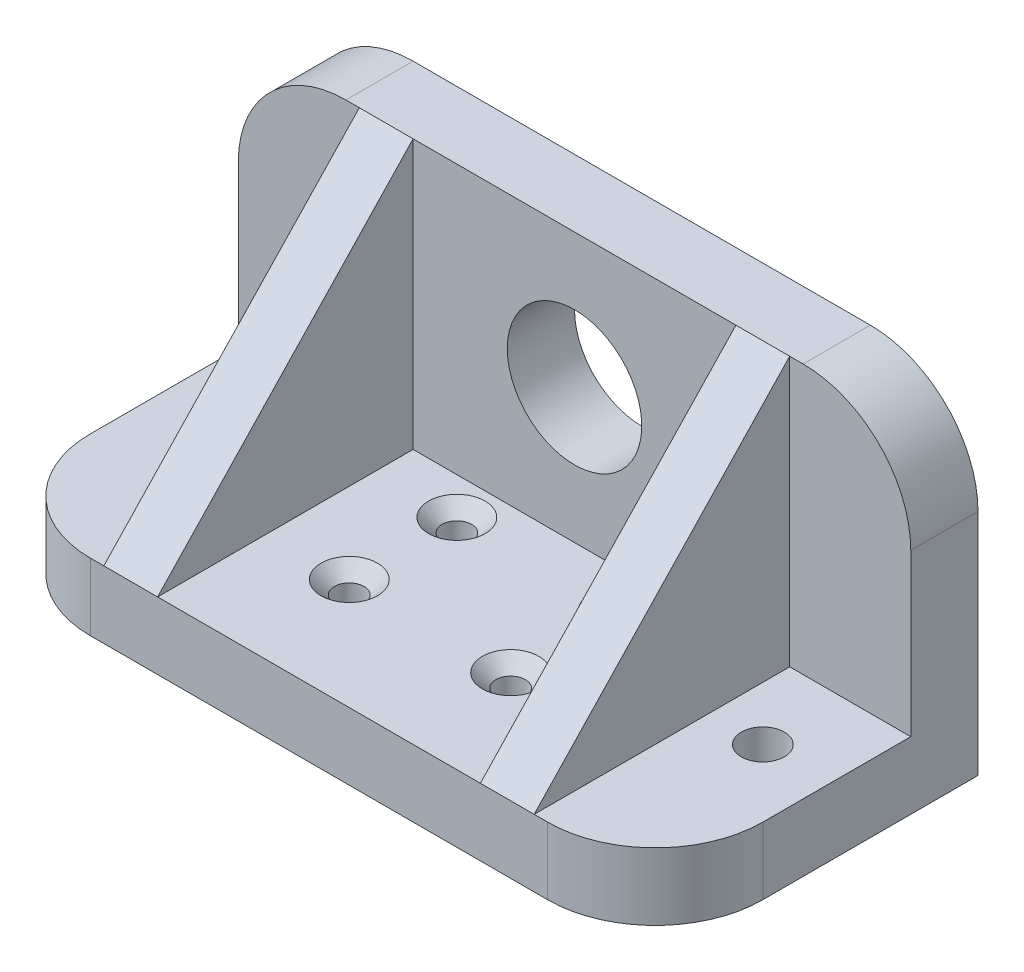
from build123d import *

# Parameters (mm, degrees)
SKETCH_1_W          = 50
SKETCH_1_H          = 24
EXTRUDE_1_DEPTH     = 5
SKETCH_2_W          = 50
SKETCH_2_H          = 5
EXTRUDE_2_DEPTH     = 20
SKETCH_3_W          = 4
SKETCH_3_H          = 19
EXTRUDE_3_DEPTH     = 20
CUT_EXTRUDE_1_DEPTH = 50.497474683
SKETCH_6_R          = 1.1
CUT_EXTRUDE_2_DEPTH = 35.190641995
SKETCH_7_R          = 5
CUT_EXTRUDE_3_DEPTH = 43.731721238
SKETCH_8_R          = 1.6
CUT_EXTRUDE_4_DEPTH = 35.190641995
FILLET_1_R          = 8
CHAMFER_1_SIZE      = 1


with BuildPart() as part:
    # 草图1 → 凸台-拉伸1 (new body)
    with BuildSketch(Plane(origin=(0, 0, 0), x_dir=(1, 0, 0), z_dir=(0, 1, 0))):
        Rectangle(SKETCH_1_W, SKETCH_1_H)
    extrude(amount=EXTRUDE_1_DEPTH)

    # 草图2 → 凸台-拉伸2 (add)
    with BuildSketch(Plane(origin=(0, 5, 0), x_dir=(1, 0, 0), z_dir=(0, 1, 0))):
        with Locations((0, 9.5)):
            Rectangle(SKETCH_2_W, SKETCH_2_H)
    extrude(amount=EXTRUDE_2_DEPTH)

    # 草图3 → 凸台-拉伸3 (add)
    with BuildSketch(Plane(origin=(0, 5, 0), x_dir=(1, 0, 0), z_dir=(0, 1, 0))):
        with Locations((14, -2.5)):
            Rectangle(SKETCH_3_W, SKETCH_3_H)
        with Locations((-14, -2.5)):
            Rectangle(SKETCH_3_W, SKETCH_3_H)
    extrude(amount=EXTRUDE_3_DEPTH)

    # 草图4 → 切除-拉伸1 (cut, through all)
    with BuildSketch(Plane.ZY.offset(16)):
        Polygon((-7, 25), (12, 5), (12, 25), align=None)
    extrude(amount=-CUT_EXTRUDE_1_DEPTH, mode=Mode.SUBTRACT)

    # 草图6 → 切除-拉伸2 (cut, through all)
    with BuildSketch(Plane(origin=(0, 5, 0), x_dir=(1, 0, 0), z_dir=(0, 1, 0))):
        with Locations(Location((6, 4.25, 0), (0, 0, 270))):
            Circle(SKETCH_6_R)
        with Locations(Location((6, -3.75, 0), (0, 0, 270))):
            Circle(SKETCH_6_R)
        with Locations(Location((-6, 4.25, 0), (0, 0, 90))):
            Circle(SKETCH_6_R)
        with Locations(Location((-6, -3.75, 0), (0, 0, 90))):
            Circle(SKETCH_6_R)
    extrude(amount=-CUT_EXTRUDE_2_DEPTH, mode=Mode.SUBTRACT)

    # 草图7 → 切除-拉伸3 (cut, through all)
    with BuildSketch(Plane(origin=(0, 0, -12), x_dir=(-1, 0, 0), z_dir=(0, 0, -1))):
        with Locations((0, 15)):
            Circle(SKETCH_7_R)
    extrude(amount=-CUT_EXTRUDE_3_DEPTH, mode=Mode.SUBTRACT)

    # 草图8 → 切除-拉伸4 (cut, through all)
    with BuildSketch(Plane(origin=(0, 5, 0), x_dir=(1, 0, 0), z_dir=(0, 1, 0))):
        with Locations(Location((20, 1, 0), (0, 0, 270))):
            Circle(SKETCH_8_R)
        with Locations(Location((-20, 1, 0), (0, 0, 90))):
            Circle(SKETCH_8_R)
    extrude(amount=-CUT_EXTRUDE_4_DEPTH, mode=Mode.SUBTRACT)

    # 圆角1
    fillet_1_edges = [part.edges().sort_by_distance(p)[0] for p in [
        (-25, 25, -9.5),
        (25, 25, -9.5),
        (25, 2.5, 12),
        (-25, 2.5, 12),
    ]]
    fillet(fillet_1_edges, radius=FILLET_1_R)

    # 倒角1
    chamfer_1_edges = [part.edges().sort_by_distance(p)[0] for p in [
        (6, 5, 2.65),
        (-6, 5, -3.15),
        (-6, 5, 4.85),
        (6, 5, -5.35),
    ]]
    chamfer(chamfer_1_edges, length=CHAMFER_1_SIZE)


solid = part.part
